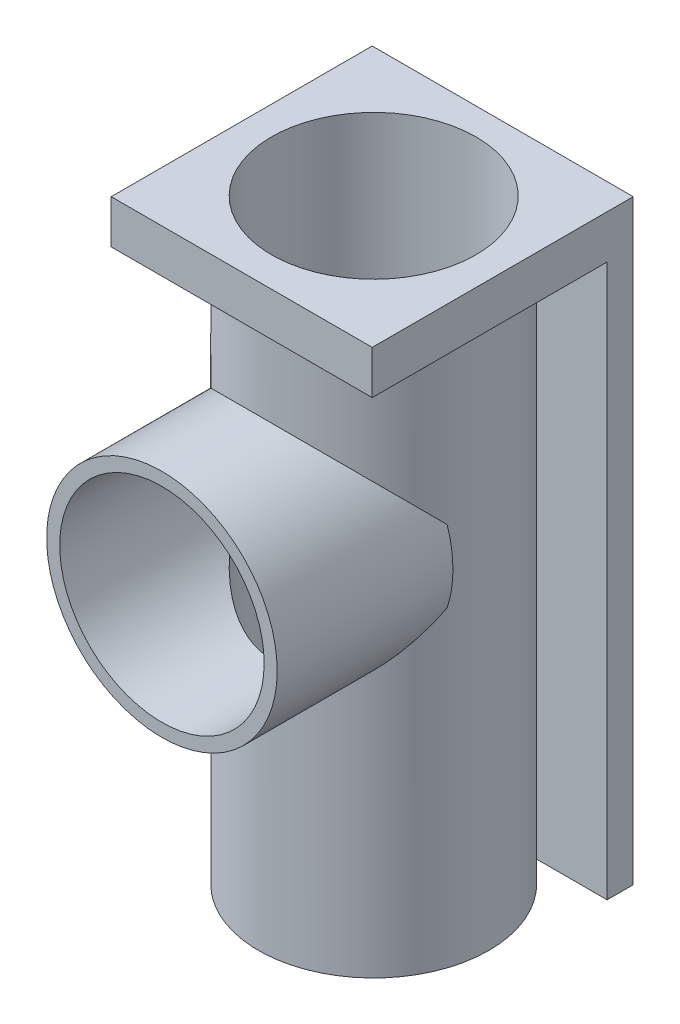
from build123d import *

# Parameters (mm, degrees)
SKETCH1_W                 = 60
SKETCH1_H                 = 60
BOSS_EXTRUDE1_DEPTH       = 10
BOSS_EXTRUDE2_DEPTH       = 127
SKETCH3_W                 = 54
SKETCH3_H                 = 54
CUT_EXTRUDE1_DEPTH        = 4
SKETCH4_W                 = 26.5
SKETCH4_H                 = 4
SKETCH5_W                 = 26.5
SKETCH5_H                 = 40.4
M42_CLEARANCE_HOLE1_D     = 47
M42_CLEARANCE_HOLE1_DEPTH = 40.8
M42_CLEARANCE_HOLE2_D     = 47


with BuildPart() as part:
    # Sketch1 → Boss-Extrude1 (new body)
    with BuildSketch(Plane.XZ.offset(-47)):
        with Locations((0, -48.345395625)):
            Rectangle(SKETCH1_W, SKETCH1_H)
    extrude(amount=-BOSS_EXTRUDE1_DEPTH)

    # Sketch2 → Boss-Extrude2 (add)
    with BuildSketch(Plane.XZ.offset(-47)):
        with BuildLine():
            Line((11.939490511, -72.345395625), (30, -72.345395625))
            Line((30, -72.345395625), (30, -78.345395625))
            Line((30, -78.345395625), (-30, -78.345395625))
            Line((-30, -78.345395625), (-30, -72.345395625))
            Line((-30, -72.345395625), (-11.939490511, -72.345395625))
            ThreePointArc((-11.939490511, -72.345395625), (0, -22.187446298), (11.939490511, -72.345395625))
        make_face()
    extrude(amount=BOSS_EXTRUDE2_DEPTH)

    # Sketch3 → Cut-Extrude1 (cut)
    with BuildSketch(Plane(origin=(0, 54, 0), x_dir=(1, 0, 0), z_dir=(0, 1, 0))):
        with Locations((0, 48.345395625)):
            Rectangle(SKETCH3_W, SKETCH3_H)
    extrude(amount=-CUT_EXTRUDE1_DEPTH, mode=Mode.SUBTRACT)

    # Sketch4 → Revolve1 (revolve)
    with BuildSketch(Plane(origin=(0, 0, -48.687446298), x_dir=(-1, 0, 0), z_dir=(0, 0, -1)), mode=Mode.PRIVATE) as revolve1_sk:
        with Locations((-13.25, 52)):
            Rectangle(SKETCH4_W, SKETCH4_H)
    revolve(revolve1_sk.sketch.rotate(Axis((0, 50, -48.687446298), (0, 1, 0)), 270), axis=Axis((0, 50, -48.687446298), (0, 1, 0)))

    # Sketch5 → Revolve2 (revolve)
    with BuildSketch(Plane(origin=(0, 0, 0), x_dir=(1, 0, 0), z_dir=(0, 1, 0))):
        with Locations((13.25, 20.2)):
            Rectangle(SKETCH5_W, SKETCH5_H)
    revolve(axis=Axis((0, 0, -40.4), (0, 0, 1)))

    # M42 Clearance Hole1
    with Locations(Plane.XY):
        with Locations((0, 0)):
            Hole(M42_CLEARANCE_HOLE1_D / 2, depth=M42_CLEARANCE_HOLE1_DEPTH)

    # M42 Clearance Hole2 (through all)
    with Locations(Plane(origin=(0, -80, 0), x_dir=(-1, 0, 0), z_dir=(0, -1, 0))):
        with Locations((0, 48.687446298)):
            Hole(M42_CLEARANCE_HOLE2_D / 2)


solid = part.part
